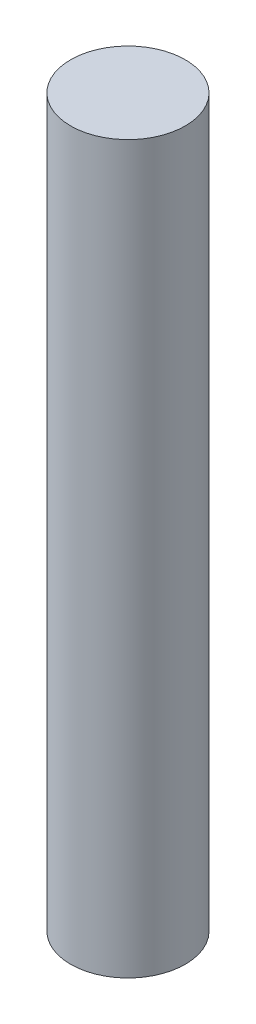
from build123d import *

# Parameters (mm, degrees)
SKETCH1_R           = 39.49
BOSS_EXTRUDE1_DEPTH = 500


with BuildPart() as part:
    # Sketch1 → Boss-Extrude1 (new body)
    with BuildSketch(Plane(origin=(0, 0, 0), x_dir=(1, 0, 0), z_dir=(0, 1, 0))):
        with Locations(Location((0, 0, 0), (0, 0, 270))):
            Circle(SKETCH1_R)
    extrude(amount=BOSS_EXTRUDE1_DEPTH)


solid = part.part
